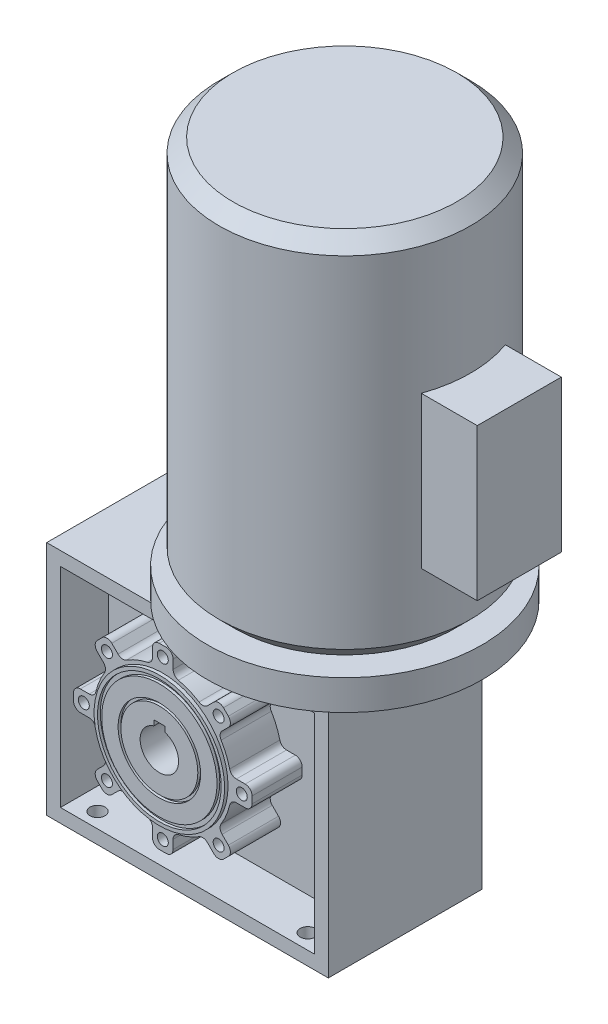
from build123d import *

# Parameters (mm, degrees)
SKETCH1_W                   = 205
SKETCH1_H                   = 172
SKETCH1_R                   = 14
BOSS_EXTRUDE1_DEPTH         = 112
SKETCH4_W                   = 185
SKETCH4_H                   = 152
SKETCH4_R                   = 50
CUT_EXTRUDE1_DEPTH          = 35
CUT_EXTRUDE2_START          = -46
SKETCH5_W                   = 185
SKETCH5_H                   = 152
SKETCH5_R                   = 50
CUT_EXTRUDE2_DEPTH          = 46
BOSS_EXTRUDE2_REACH         = 587.109
SKETCH7_R                   = 4
CUT_EXTRUDE3_DEPTH          = 586.10853694
FILLET1_R                   = 5
CIRPATTERN1_COUNT           = 8
FILLET1_OF_CIRPATTERN1_R    = 5
BOSS_EXTRUDE_START          = 1.5
SKETCH8_R                   = 4
SKETCH8_R_2                 = 14
BOSS_EXTRUDE_ONE_SIDE_DEPTH = 1.5
BOSS_EXTRUDE5_START         = 2.5
SKETCH9_R                   = 47.5
SKETCH9_R_2                 = 14
BOSS_EXTRUDE5_DEPTH         = 2.5
SKETCH10_R                  = 45
SKETCH10_R_2                = 42
CUT_EXTRUDE4_DEPTH          = 2
SKETCH11_R                  = 30
SKETCH11_R_2                = 28
CUT_EXTRUDE5_DEPTH          = 2
SKETCH12_W                  = 61.185896752
SKETCH12_H                  = 110.397308301
BOSS_EXTRUDE6_DEPTH         = 83
SKETCH14_R                  = 5.5
CUT_EXTRUDE6_DEPTH          = 15
CUT_EXTRUDE7_DEPTH          = 601.274104056


with BuildPart() as part:
    # Sketch1 → Boss-Extrude1 (new body)
    with BuildSketch(Plane.XY):
        with Locations((137.5, 86)):
            Rectangle(SKETCH1_W, SKETCH1_H)
        with Locations((121, 86)):
            Circle(SKETCH1_R, mode=Mode.SUBTRACT)
    extrude(amount=-BOSS_EXTRUDE1_DEPTH)

    # Sketch2 → Motor (revolve)
    with BuildSketch(Plane.XY.offset(-56), mode=Mode.PRIVATE) as motor_sk:
        Polygon((275.70575939, 210), (287.533482614, 221.827723224), (287.533482614, 469.917257145), (277.450739759, 480), (196, 480), (196, 172), (237.668295749, 172), (237.668295749, 188), (296, 188), (296, 199), (296, 210), align=None)
    revolve(motor_sk.sketch.rotate(Axis((196, 62.148817078, -56), (0, 1, 0)), 90), axis=Axis((196, 62.148817078, -56), (0, 1, 0)))

    # Sketch4 → Cut-Extrude1 (cut)
    with BuildSketch(Plane.XY):
        with Locations((137.5, 86)):
            Rectangle(SKETCH4_W, SKETCH4_H)
        with Locations((121, 86)):
            Circle(SKETCH4_R, mode=Mode.SUBTRACT)
    extrude(amount=-CUT_EXTRUDE1_DEPTH, mode=Mode.SUBTRACT)

    # Sketch5 → Cut-Extrude2 (cut)
    with BuildSketch(Plane(origin=(0, 0, -112), x_dir=(-1, 0, 0), z_dir=(0, 0, -1)).offset(CUT_EXTRUDE2_START)):
        with Locations((-137.5, 86)):
            Rectangle(SKETCH5_W, SKETCH5_H)
        with Locations(Location((-121, 86, 0), (0, 0, 180))):
            Circle(SKETCH5_R, mode=Mode.SUBTRACT)
    extrude(amount=CUT_EXTRUDE2_DEPTH, mode=Mode.SUBTRACT)

    # Boss-Extrude2: up to this face of the body (flat: up to its plane)
    boss_extrude2_end = Plane(part.part.faces().sort_by_distance((72.414213562, 86, -112))[0])
    # Sketch6 → Boss-Extrude2 (add, up to the picked face)
    with BuildSketch(Plane.XY, mode=Mode.PRIVATE) as boss_extrude2_sk1:
        with BuildLine():
            Line((113.5, 135.434299833), (113.5, 151))
            Line((113.5, 151), (128.5, 151))
            Line((128.5, 151), (128.5, 135.434299833))
            ThreePointArc((128.5, 135.434299833), (121, 136), (113.5, 135.434299833))
        make_face()
    boss_extrude2_tool1 = split(extrude(boss_extrude2_sk1.sketch, amount=-BOSS_EXTRUDE2_REACH, mode=Mode.PRIVATE), bisect_by=boss_extrude2_end, keep=Keep.BOTH, mode=Mode.PRIVATE)
    boss_extrude2 = boss_extrude2_tool1.solids().sort_by(Axis((121, 143.404996, 0), (0, 0, -1)))[0]
    add(boss_extrude2)

    # Sketch7 → Cut-Extrude3 (cut, through all)
    with BuildSketch(Plane.XY):
        with Locations((121, 143.5)):
            Circle(SKETCH7_R)
    cut_extrude3 = extrude(amount=-CUT_EXTRUDE3_DEPTH, mode=Mode.SUBTRACT)

    # Fillet1
    fillet1_edges = [part.edges().sort_by_distance(p)[0] for p in [
        (128.5, 135.434299833, -17.5),
        (113.5, 151, -17.5),
        (113.5, 135.434299833, -17.5),
        (128.5, 151, -17.5),
        (128.5, 135.434299833, -89),
        (113.5, 135.434299833, -89),
        (113.5, 151, -89),
        (128.5, 151, -89),
    ]]
    fillet(fillet1_edges, radius=FILLET1_R)

    # CirPattern1: Boss-Extrude2, Cut-Extrude3 ×8 about axis
    cirpattern1_axis = Axis((121, 86, 0), (0, 0, 1))
    add([boss_extrude2.rotate(cirpattern1_axis, i * 360 / CIRPATTERN1_COUNT) for i in range(1, CIRPATTERN1_COUNT)])
    add([cut_extrude3.rotate(cirpattern1_axis, i * 360 / CIRPATTERN1_COUNT) for i in range(1, CIRPATTERN1_COUNT)], mode=Mode.SUBTRACT)

    # Fillet1 of CirPattern1
    fillet1_of_cirpattern1_edges = [part.edges().sort_by_distance(p)[0] for p in [
        (91.347972224, 126.258629494, -17.5),
        (69.734758364, 126.658639918, -17.5),
        (80.741370506, 115.652027776, -17.5),
        (80.341360082, 137.265241636, -17.5),
        (91.347972224, 126.258629494, -89),
        (80.741370506, 115.652027776, -89),
        (69.734758364, 126.658639918, -89),
        (80.341360082, 137.265241636, -89),
        (71.565700167, 93.5, -17.5),
        (56, 78.5, -17.5),
        (71.565700167, 78.5, -17.5),
        (56, 93.5, -17.5),
        (71.565700167, 93.5, -89),
        (71.565700167, 78.5, -89),
        (56, 78.5, -89),
        (56, 93.5, -89),
        (80.741370506, 56.347972224, -17.5),
        (80.341360082, 34.734758364, -17.5),
        (91.347972224, 45.741370506, -17.5),
        (69.734758364, 45.341360082, -17.5),
        (80.741370506, 56.347972224, -89),
        (91.347972224, 45.741370506, -89),
        (80.341360082, 34.734758364, -89),
        (69.734758364, 45.341360082, -89),
        (113.5, 36.565700167, -17.5),
        (128.5, 21, -17.5),
        (128.5, 36.565700167, -17.5),
        (113.5, 21, -17.5),
        (113.5, 36.565700167, -89),
        (128.5, 36.565700167, -89),
        (128.5, 21, -89),
        (113.5, 21, -89),
        (150.652027776, 45.741370506, -17.5),
        (172.265241636, 45.341360082, -17.5),
        (161.258629494, 56.347972224, -17.5),
        (161.658639918, 34.734758364, -17.5),
        (150.652027776, 45.741370506, -89),
        (161.258629494, 56.347972224, -89),
        (172.265241636, 45.341360082, -89),
        (161.658639918, 34.734758364, -89),
        (170.434299833, 78.5, -17.5),
        (186, 93.5, -17.5),
        (170.434299833, 93.5, -17.5),
        (186, 78.5, -17.5),
        (170.434299833, 78.5, -89),
        (170.434299833, 93.5, -89),
        (186, 93.5, -89),
        (186, 78.5, -89),
        (161.258629494, 115.652027776, -17.5),
        (161.658639918, 137.265241636, -17.5),
        (150.652027776, 126.258629494, -17.5),
        (172.265241636, 126.658639918, -17.5),
        (161.258629494, 115.652027776, -89),
        (150.652027776, 126.258629494, -89),
        (161.658639918, 137.265241636, -89),
        (172.265241636, 126.658639918, -89),
    ]]
    fillet(fillet1_of_cirpattern1_edges, radius=FILLET1_OF_CIRPATTERN1_R)

    # Sketch8 → Boss-Extrude one side (add)
    with BuildSketch(Plane.XY.offset(BOSS_EXTRUDE_START)):
        with BuildLine():
            Line((88.43015734, 129.176444378), (83.876893988, 133.72970773))
            ThreePointArc((83.876893988, 133.72970773), (80.341360082, 135.194173824), (76.805826176, 133.72970773))
            Line((76.805826176, 133.72970773), (73.27029227, 130.194173824))
            ThreePointArc((73.27029227, 130.194173824), (71.805826176, 126.658639918), (73.27029227, 123.123106012))
            Line((73.27029227, 123.123106012), (77.823555622, 118.56984266))
            ThreePointArc((77.823555622, 118.56984266), (79.255202946, 115.606244619), (78.534565197, 112.39482614))
            ThreePointArc((78.534565197, 112.39482614), (74.806023374, 105.134171618), (72.308442533, 97.363636364))
            ThreePointArc((72.308442533, 97.363636364), (70.547194588, 94.583252741), (67.439286786, 93.5))
            Line((67.439286786, 93.5), (61, 93.5))
            ThreePointArc((61, 93.5), (57.464466094, 92.035533906), (56, 88.5))
            Line((56, 88.5), (56, 83.5))
            ThreePointArc((56, 83.5), (57.464466094, 79.964466094), (61, 78.5))
            Line((61, 78.5), (67.439286786, 78.5))
            ThreePointArc((67.439286786, 78.5), (70.547194588, 77.416747259), (72.308442533, 74.636363636))
            ThreePointArc((72.308442533, 74.636363636), (74.806023374, 66.865828382), (78.534565197, 59.60517386))
            ThreePointArc((78.534565197, 59.60517386), (79.255202946, 56.393755381), (77.823555622, 53.43015734))
            Line((77.823555622, 53.43015734), (73.27029227, 48.876893988))
            ThreePointArc((73.27029227, 48.876893988), (71.805826176, 45.341360082), (73.27029227, 41.805826176))
            Line((73.27029227, 41.805826176), (76.805826176, 38.27029227))
            ThreePointArc((76.805826176, 38.27029227), (80.341360082, 36.805826176), (83.876893988, 38.27029227))
            Line((83.876893988, 38.27029227), (88.43015734, 42.823555622))
            ThreePointArc((88.43015734, 42.823555622), (91.393755381, 44.255202946), (94.60517386, 43.534565197))
            ThreePointArc((94.60517386, 43.534565197), (101.865828382, 39.806023374), (109.636363636, 37.308442533))
            ThreePointArc((109.636363636, 37.308442533), (112.416747259, 35.547194588), (113.5, 32.439286786))
            Line((113.5, 32.439286786), (113.5, 26))
            ThreePointArc((113.5, 26), (114.964466094, 22.464466094), (118.5, 21))
            Line((118.5, 21), (123.5, 21))
            ThreePointArc((123.5, 21), (127.035533906, 22.464466094), (128.5, 26))
            Line((128.5, 26), (128.5, 32.439286786))
            ThreePointArc((128.5, 32.439286786), (129.583252741, 35.547194588), (132.363636364, 37.308442533))
            ThreePointArc((132.363636364, 37.308442533), (140.134171618, 39.806023374), (147.39482614, 43.534565197))
            ThreePointArc((147.39482614, 43.534565197), (150.606244619, 44.255202946), (153.56984266, 42.823555622))
            Line((153.56984266, 42.823555622), (158.123106012, 38.27029227))
            ThreePointArc((158.123106012, 38.27029227), (161.658639918, 36.805826176), (165.194173824, 38.27029227))
            Line((165.194173824, 38.27029227), (168.72970773, 41.805826176))
            ThreePointArc((168.72970773, 41.805826176), (170.194173824, 45.341360082), (168.72970773, 48.876893988))
            Line((168.72970773, 48.876893988), (164.176444378, 53.43015734))
            ThreePointArc((164.176444378, 53.43015734), (162.744797054, 56.393755381), (163.465434803, 59.60517386))
            ThreePointArc((163.465434803, 59.60517386), (167.193976626, 66.865828382), (169.691557467, 74.636363636))
            ThreePointArc((169.691557467, 74.636363636), (171.452805412, 77.416747259), (174.560713214, 78.5))
            Line((174.560713214, 78.5), (181, 78.5))
            ThreePointArc((181, 78.5), (184.535533906, 79.964466094), (186, 83.5))
            Line((186, 83.5), (186, 88.5))
            ThreePointArc((186, 88.5), (184.535533906, 92.035533906), (181, 93.5))
            Line((181, 93.5), (174.560713214, 93.5))
            ThreePointArc((174.560713214, 93.5), (171.452805412, 94.583252741), (169.691557467, 97.363636364))
            ThreePointArc((169.691557467, 97.363636364), (167.193976626, 105.134171618), (163.465434803, 112.39482614))
            ThreePointArc((163.465434803, 112.39482614), (162.744797054, 115.606244619), (164.176444378, 118.56984266))
            Line((164.176444378, 118.56984266), (168.72970773, 123.123106012))
            ThreePointArc((168.72970773, 123.123106012), (170.194173824, 126.658639918), (168.72970773, 130.194173824))
            Line((168.72970773, 130.194173824), (165.194173824, 133.72970773))
            ThreePointArc((165.194173824, 133.72970773), (161.658639918, 135.194173824), (158.123106012, 133.72970773))
            Line((158.123106012, 133.72970773), (153.56984266, 129.176444378))
            ThreePointArc((153.56984266, 129.176444378), (150.606244619, 127.744797054), (147.39482614, 128.465434803))
            ThreePointArc((147.39482614, 128.465434803), (140.134171618, 132.193976626), (132.363636364, 134.691557467))
            ThreePointArc((132.363636364, 134.691557467), (129.583252741, 136.452805412), (128.5, 139.560713214))
            Line((128.5, 139.560713214), (128.5, 146))
            ThreePointArc((128.5, 146), (127.035533906, 149.535533906), (123.5, 151))
            Line((123.5, 151), (118.5, 151))
            ThreePointArc((118.5, 151), (114.964466094, 149.535533906), (113.5, 146))
            Line((113.5, 146), (113.5, 139.560713214))
            ThreePointArc((113.5, 139.560713214), (112.416747259, 136.452805412), (109.636363636, 134.691557467))
            ThreePointArc((109.636363636, 134.691557467), (101.865828382, 132.193976626), (94.60517386, 128.465434803))
            ThreePointArc((94.60517386, 128.465434803), (91.393755381, 127.744797054), (88.43015734, 129.176444378))
        make_face()
        with Locations((161.658639918, 45.341360082)):
            Circle(SKETCH8_R, mode=Mode.SUBTRACT)
        with Locations((121, 28.5)):
            Circle(SKETCH8_R, mode=Mode.SUBTRACT)
        with Locations((80.341360082, 45.341360082)):
            Circle(SKETCH8_R, mode=Mode.SUBTRACT)
        with Locations((63.5, 86)):
            Circle(SKETCH8_R, mode=Mode.SUBTRACT)
        with Locations((178.5, 86)):
            Circle(SKETCH8_R, mode=Mode.SUBTRACT)
        with Locations((161.658639918, 126.658639918)):
            Circle(SKETCH8_R, mode=Mode.SUBTRACT)
        with Locations((121, 86)):
            Circle(SKETCH8_R_2, mode=Mode.SUBTRACT)
        with Locations((80.341360082, 126.658639918)):
            Circle(SKETCH8_R, mode=Mode.SUBTRACT)
        with Locations((121, 143.5)):
            Circle(SKETCH8_R, mode=Mode.SUBTRACT)
    boss_extrude_one_side = extrude(amount=-BOSS_EXTRUDE_ONE_SIDE_DEPTH)

    # Sketch9 → Boss-Extrude5 (add)
    with BuildSketch(Plane.XY.offset(1.5).offset(BOSS_EXTRUDE5_START)):
        with Locations((121, 86)):
            Circle(SKETCH9_R)
        with Locations((121, 86)):
            Circle(SKETCH9_R_2, mode=Mode.SUBTRACT)
    boss_extrude5 = extrude(amount=-BOSS_EXTRUDE5_DEPTH)

    # Sketch10 → Cut-Extrude4 (cut)
    with BuildSketch(Plane.XY.offset(4)):
        with Locations((121, 86)):
            Circle(SKETCH10_R)
        with Locations((121, 86)):
            Circle(SKETCH10_R_2, mode=Mode.SUBTRACT)
    cut_extrude4 = extrude(amount=-CUT_EXTRUDE4_DEPTH, mode=Mode.SUBTRACT)

    # Sketch11 → Cut-Extrude5 (cut)
    with BuildSketch(Plane.XY.offset(4)):
        with Locations((121, 86)):
            Circle(SKETCH11_R)
        with Locations((121, 86)):
            Circle(SKETCH11_R_2, mode=Mode.SUBTRACT)
    cut_extrude5 = extrude(amount=-CUT_EXTRUDE5_DEPTH, mode=Mode.SUBTRACT)

    # Sketch12 → Boss-Extrude6 (add)
    with BuildSketch(Plane(origin=(240, 0, 0), x_dir=(0, 0, -1), z_dir=(1, 0, 0))):
        with Locations((56, 321.836167597)):
            Rectangle(SKETCH12_W, SKETCH12_H)
    extrude(amount=BOSS_EXTRUDE6_DEPTH)

    # Mirror1: Boss-Extrude one side, Boss-Extrude5, Cut-Extrude4, Cut-Extrude5 across plane
    add(boss_extrude_one_side.mirror(Plane.XY.offset(-56)))
    add(boss_extrude5.mirror(Plane.XY.offset(-56)))
    add(cut_extrude4.mirror(Plane.XY.offset(-56)), mode=Mode.SUBTRACT)
    add(cut_extrude5.mirror(Plane.XY.offset(-56)), mode=Mode.SUBTRACT)

    # Sketch14 → Cut-Extrude6 (cut)
    with BuildSketch(Plane.XZ):
        with Locations((214, -11)):
            Circle(SKETCH14_R)
        with Locations((214, -101)):
            Circle(SKETCH14_R)
        with Locations((61, -101)):
            Circle(SKETCH14_R)
        with Locations((61, -11)):
            Circle(SKETCH14_R)
    extrude(amount=-CUT_EXTRUDE6_DEPTH, mode=Mode.SUBTRACT)

    # Sketch15 → Cut-Extrude7 (cut, through all)
    with BuildSketch(Plane.XY.offset(4)):
        with BuildLine():
            Line((125, 99.416407865), (125, 103.3))
            Line((125, 103.3), (117, 103.3))
            Line((117, 103.3), (117, 99.416407865))
            ThreePointArc((117, 99.416407865), (121, 100), (125, 99.416407865))
        make_face()
    extrude(amount=-CUT_EXTRUDE7_DEPTH, mode=Mode.SUBTRACT)


solid = part.part
